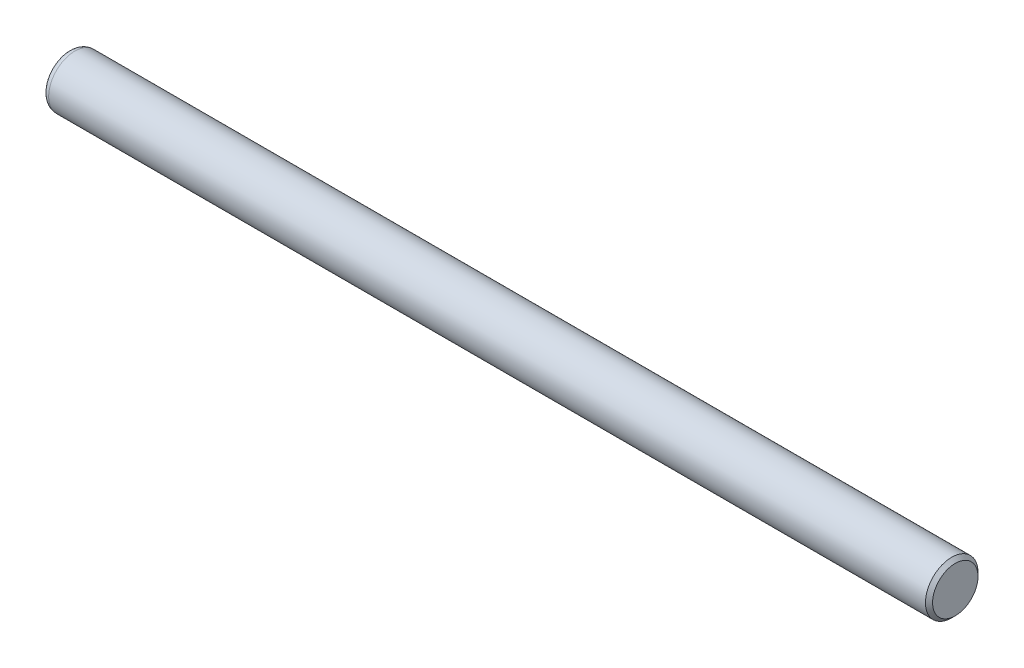
from build123d import *

# Parameters (mm, degrees)
SCHNITT_LINEAR_AUSTRAGEN1_DEPTH      = 1001.015999872
SCHNITT_LINEAR_AUSTRAGEN1_DEPTH_BACK = 1001.015999872
SKIZZE2_W                            = 870
SKIZZE2_H                            = 18
VERRUNDUNG1_R                        = 1


with BuildPart() as part:
    # Skizze1 → Rotation1 (revolve)
    with BuildSketch(Plane.XY, mode=Mode.PRIVATE) as rotation1_sk:
        Polygon((0, 3.45875), (0, 0), (1000, 0), (1000, 3.45875), (999.45875, 4), (0.54125, 4), align=None)
    revolve(rotation1_sk.sketch.rotate(Axis((0, 0, 0), (1, 0, 0)), 270), axis=Axis((0, 0, 0), (1, 0, 0)))

    # Skizze2 → Schnitt-Linear austragen1 (cut, two sides: drawn at the far end of the back side and taken through both)
    with BuildSketch(Plane.XY.offset(-SCHNITT_LINEAR_AUSTRAGEN1_DEPTH_BACK)):
        with Locations((430, 0)):
            Rectangle(SKIZZE2_W, SKIZZE2_H)
    extrude(amount=SCHNITT_LINEAR_AUSTRAGEN1_DEPTH + SCHNITT_LINEAR_AUSTRAGEN1_DEPTH_BACK, mode=Mode.SUBTRACT)

    # Verrundung1
    verrundung1_edges = [part.edges().sort_by_distance(p)[0] for p in [
        (865, 0, 4),
    ]]
    fillet(verrundung1_edges, radius=VERRUNDUNG1_R)


solid = part.part
